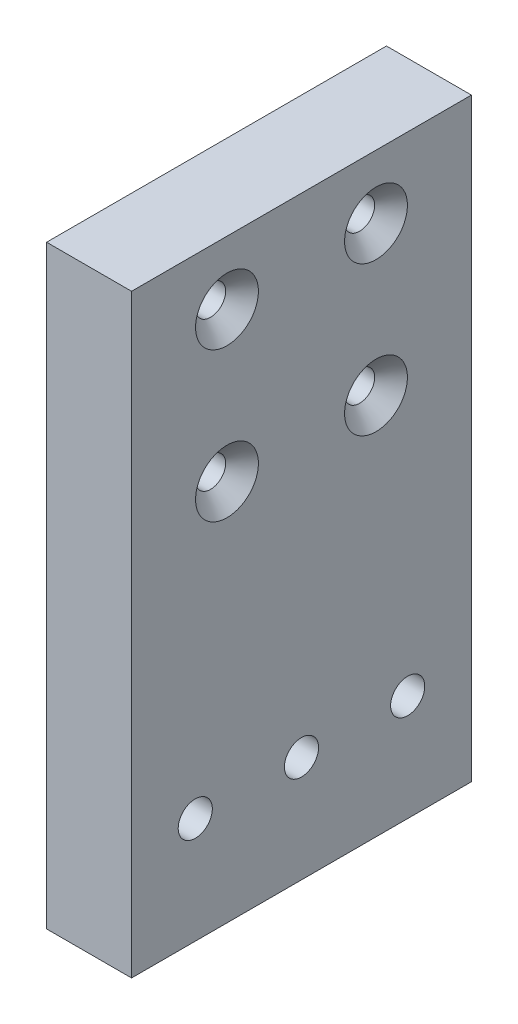
from build123d import *

# Parameters (mm, degrees)
SKETCH1_W                                       = 50.8
SKETCH1_H                                       = 88.9
BOSS_EXTRUDE1_DEPTH                             = 12.7
CSK_FOR_M4_FLAT_HEAD_MACHINE_SCREW1_D           = 4.5
CSK_FOR_M4_FLAT_HEAD_MACHINE_SCREW1_CSINK_D     = 9.4
CSK_FOR_M4_FLAT_HEAD_MACHINE_SCREW1_CSINK_ANGLE = 90
CBORE_FOR_10_SOCKET_HEAD_CAP_SCREW1_D           = 5.1054
CBORE_FOR_10_SOCKET_HEAD_CAP_SCREW1_CBORE_D     = 9.525
CBORE_FOR_10_SOCKET_HEAD_CAP_SCREW1_CBORE_DEPTH = 4.826


with BuildPart() as part:
    # Sketch1 → Boss-Extrude1 (new body)
    with BuildSketch(Plane(origin=(0, 0, 0), x_dir=(0, 0, -1), z_dir=(1, 0, 0))):
        Rectangle(SKETCH1_W, SKETCH1_H)
    extrude(amount=BOSS_EXTRUDE1_DEPTH)

    # CSK for M4 Flat Head Machine Screw1 (through all)
    with Locations(Plane(origin=(12.7, 0, 0), x_dir=(0, 0, -1), z_dir=(1, 0, 0))):
        with Locations((11.136931804, 34.973863607), (-11.136931804, 34.973863607), (-11.136931804, 12.7), (11.136931804, 12.7)):
            CounterSinkHole(CSK_FOR_M4_FLAT_HEAD_MACHINE_SCREW1_D / 2, CSK_FOR_M4_FLAT_HEAD_MACHINE_SCREW1_CSINK_D / 2, counter_sink_angle=CSK_FOR_M4_FLAT_HEAD_MACHINE_SCREW1_CSINK_ANGLE)

    # CBORE for #10 Socket Head Cap Screw1 (through all)
    with Locations(Plane.ZY):
        with Locations((-15.875, -28.575), (0, -28.575), (15.875, -28.575)):
            CounterBoreHole(CBORE_FOR_10_SOCKET_HEAD_CAP_SCREW1_D / 2, CBORE_FOR_10_SOCKET_HEAD_CAP_SCREW1_CBORE_D / 2, CBORE_FOR_10_SOCKET_HEAD_CAP_SCREW1_CBORE_DEPTH)


solid = part.part
